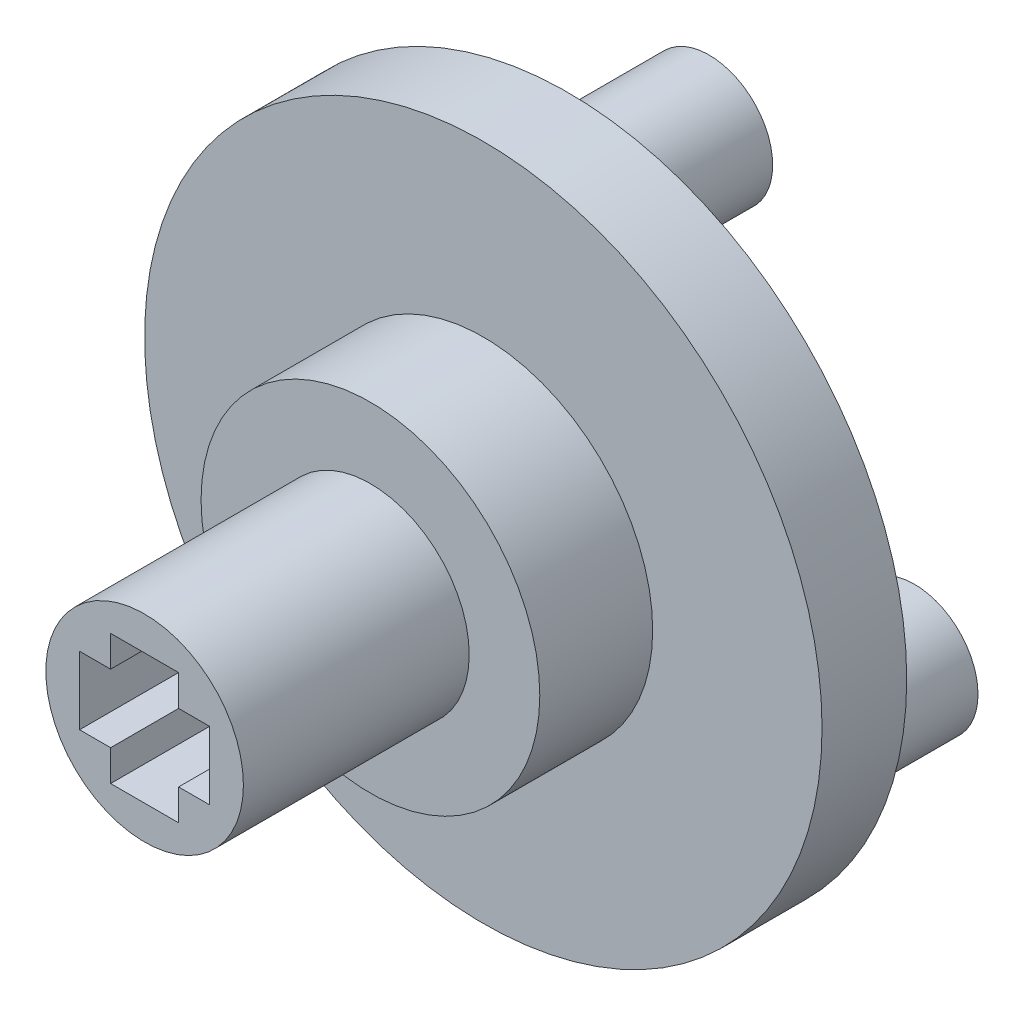
from build123d import *

# Parameters (mm, degrees)
SKETCH_1_R      = 12
SKETCH_1_R_2    = 2
EXTRUDE_1_DEPTH = 3
SKETCH_1_3_R    = 2.25
EXTRUDE_2_DEPTH = 5
EXTRUDE_START   = 3
SKETCH_1_4_R    = 6
SKETCH_1_4_R_2  = 2
EXTRUDE_3_DEPTH = 3
EXTRUDE_START_2 = 6
SKETCH_1_5_R    = 6
EXTRUDE_5_DEPTH = 1
SKETCH_2_R      = 3.5
EXTRUDE_4_DEPTH = 8


with BuildPart() as part:
    # 草图1 → 凸台-拉伸1 (new body)
    with BuildSketch(Plane.XY):
        Circle(SKETCH_1_R)
        Circle(SKETCH_1_R_2, mode=Mode.SUBTRACT)
    extrude(amount=EXTRUDE_1_DEPTH)

    # 草图1<3> → 凸台-拉伸2 (add)
    with BuildSketch(Plane.XY):
        with Locations((0, 8.4)):
            Circle(SKETCH_1_3_R)
        with Locations((7.274613392, -4.2)):
            Circle(SKETCH_1_3_R)
        with Locations((-7.274613392, -4.2)):
            Circle(SKETCH_1_3_R)
    extrude(amount=-EXTRUDE_2_DEPTH)

    # 草图1<4> → 凸台-拉伸3 (add)
    with BuildSketch(Plane.XY.offset(EXTRUDE_START)):
        Circle(SKETCH_1_4_R)
        Circle(SKETCH_1_4_R_2, mode=Mode.SUBTRACT)
    extrude(amount=EXTRUDE_3_DEPTH)

    # 草图1<5> → 凸台-拉伸5 (add)
    with BuildSketch(Plane.XY.offset(EXTRUDE_START_2)):
        Circle(SKETCH_1_5_R)
    extrude(amount=EXTRUDE_5_DEPTH)

    # 草图2 → 凸台-拉伸4 (add)
    with BuildSketch(Plane.XY.offset(7)):
        Circle(SKETCH_2_R)
        Polygon((-1.204280479, -1.204280479), (-2.304280479, -1.204280479), (-2.304280479, 1.204280479), (-1.204280479, 1.204280479), (-1.204280479, 2.304280479), (1.204280479, 2.304280479), (1.204280479, 1.204280479), (2.304280479, 1.204280479), (2.304280479, -1.204280479), (1.204280479, -1.204280479), (1.204280479, -2.304280479), (-1.204280479, -2.304280479), align=None, mode=Mode.SUBTRACT)
    extrude(amount=EXTRUDE_4_DEPTH)


solid = part.part
